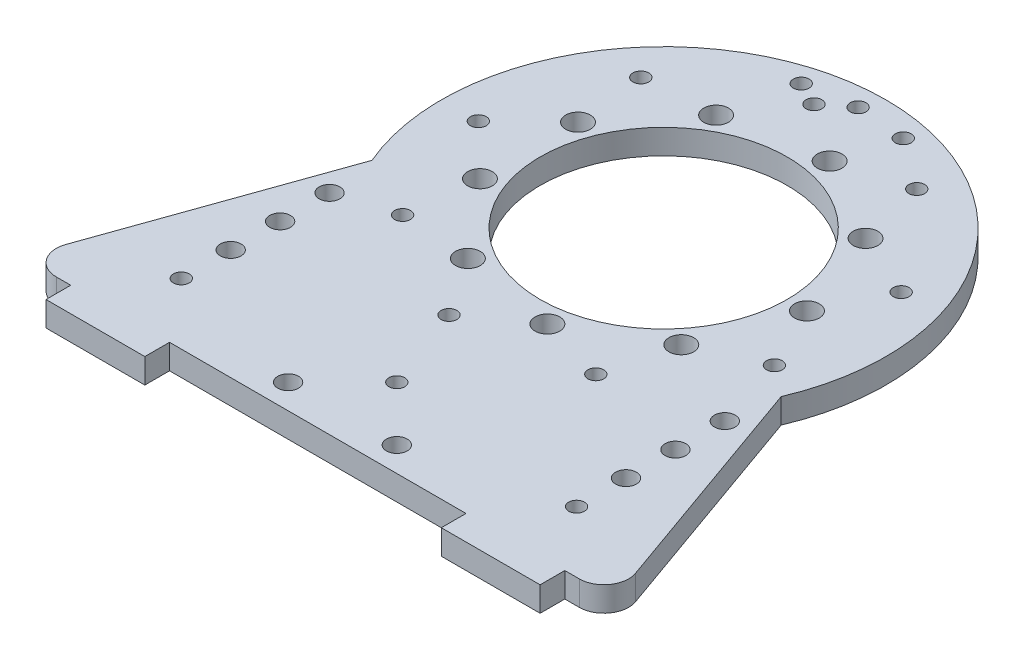
from build123d import *

# Parameters (mm, degrees)
SKETCH_1_R          = 25
SKETCH_1_R_2        = 1.6
SKETCH_1_R_3        = 2.1
EXTRUDE_1_DEPTH     = 2.5
SKETCH_3_R          = 2.5
CUT_EXTRUDE_1_DEPTH = 10
SKETCH_4_R          = 2.1
CUT_EXTRUDE_2_DEPTH = 10
SKETCH_5_W          = 20
SKETCH_5_H          = 5
EXTRUDE_2_DEPTH     = 5
CUT_EXTRUDE_3_DEPTH = 97.176920308
FILLET_1_R          = 5


with BuildPart() as part:
    # 草图1 → 凸台-拉伸1 (new, symmetric)
    with BuildSketch(Plane(origin=(0, 0, 0), x_dir=(1, 0, 0), z_dir=(0, 1, 0))):
        with BuildLine():
            Line((-60, 0), (-60, -70))
            Line((-60, -70), (60, -70))
            Line((60, -70), (60, 0))
            ThreePointArc((60, 0), (42.426406871, 42.426406871), (0, 60))
            ThreePointArc((0, 60), (-42.426406871, 42.426406871), (-60, 0))
        make_face()
        with Locations(Location((0, 0, 0), (0, 0, 270))):
            Circle(SKETCH_1_R, mode=Mode.SUBTRACT)
        with Locations(Location((-40, -57.62, 0), (0, 0, 270))):
            Circle(SKETCH_1_R_2, mode=Mode.SUBTRACT)
        with Locations(Location((40, -57.62, 0), (0, 0, 90))):
            Circle(SKETCH_1_R_2, mode=Mode.SUBTRACT)
        with Locations(Location((-37.5, 0, 0), (0, 0, 270))):
            Circle(SKETCH_1_R_2, mode=Mode.SUBTRACT)
        with Locations(Location((-28.726666617, 24.104535363, 0), (0, 0, 270))):
            Circle(SKETCH_1_R_2, mode=Mode.SUBTRACT)
        with Locations(Location((-6.511806663, 36.930290738, 0), (0, 0, 270))):
            Circle(SKETCH_1_R_2, mode=Mode.SUBTRACT)
        with Locations(Location((18.75, 32.475952642, 0), (0, 0, 270))):
            Circle(SKETCH_1_R_2, mode=Mode.SUBTRACT)
        with Locations(Location((35.238473279, 12.825755375, 0), (0, 0, 270))):
            Circle(SKETCH_1_R_2, mode=Mode.SUBTRACT)
        with Locations(Location((35.238473279, -12.825755375, 0), (0, 0, 270))):
            Circle(SKETCH_1_R_2, mode=Mode.SUBTRACT)
        with Locations(Location((18.75, -32.475952642, 0), (0, 0, 270))):
            Circle(SKETCH_1_R_2, mode=Mode.SUBTRACT)
        with Locations(Location((-6.511806663, -36.930290738, 0), (0, 0, 270))):
            Circle(SKETCH_1_R_2, mode=Mode.SUBTRACT)
        with Locations(Location((-28.726666617, -24.104535363, 0), (0, 0, 270))):
            Circle(SKETCH_1_R_2, mode=Mode.SUBTRACT)
        with Locations(Location((-11, -65, 0), (0, 0, 270))):
            Circle(SKETCH_1_R_3, mode=Mode.SUBTRACT)
        with Locations(Location((11, -65, 0), (0, 0, 90))):
            Circle(SKETCH_1_R_3, mode=Mode.SUBTRACT)
        with Locations(Location((0, -54, 0), (0, 0, 270))):
            Circle(SKETCH_1_R_2, mode=Mode.SUBTRACT)
        with Locations(Location((8.488193337, 40, 0), (0, 0, 270))):
            Circle(SKETCH_1_R_2, mode=Mode.SUBTRACT)
        with Locations(Location((-1.511806663, 40.862744239, 0), (0, 0, 270))):
            Circle(SKETCH_1_R_2, mode=Mode.SUBTRACT)
        with Locations(Location((-11.420717282, 39.263426275, 0), (0, 0, 270))):
            Circle(SKETCH_1_R_2, mode=Mode.SUBTRACT)
    extrude(amount=EXTRUDE_1_DEPTH, both=True)

    # 草图3 → 切除-拉伸1 (cut)
    with BuildSketch(Plane(origin=(0, 2.5, 0), x_dir=(1, 0, 0), z_dir=(0, 1, 0))):
        with Locations(Location((-27.251086003, -9.918584156, 0), (0, 0, 270))):
            Circle(SKETCH_3_R)
        with Locations(Location((-14.5, 25.11473671, 0), (0, 0, 270))):
            Circle(SKETCH_3_R)
        with Locations(Location((5.035797152, 28.559424837, 0), (0, 0, 270))):
            Circle(SKETCH_3_R)
        with Locations(Location((22.21528885, 18.640840681, 0), (0, 0, 270))):
            Circle(SKETCH_3_R)
        with Locations(Location((29, 0, 0), (0, 0, 270))):
            Circle(SKETCH_3_R)
        with Locations(Location((22.21528885, -18.640840681, 0), (0, 0, 270))):
            Circle(SKETCH_3_R)
        with Locations(Location((5.035797152, -28.559424837, 0), (0, 0, 270))):
            Circle(SKETCH_3_R)
        with Locations(Location((-14.5, -25.11473671, 0), (0, 0, 270))):
            Circle(SKETCH_3_R)
        with Locations(Location((-27.251086003, 9.918584156, 0), (0, 0, 270))):
            Circle(SKETCH_3_R)
    extrude(amount=-CUT_EXTRUDE_1_DEPTH, mode=Mode.SUBTRACT)

    # 草图4 → 切除-拉伸2 (cut)
    with BuildSketch(Plane(origin=(0, 2.5, 0), x_dir=(1, 0, 0), z_dir=(0, 1, 0))):
        with Locations(Location((-40, -47.62, 0), (0, 0, 270))):
            Circle(SKETCH_4_R)
        with Locations(Location((-40, -37.62, 0), (0, 0, 270))):
            Circle(SKETCH_4_R)
        with Locations(Location((-40, -27.62, 0), (0, 0, 270))):
            Circle(SKETCH_4_R)
        with Locations(Location((40, -47.62, 0), (0, 0, 270))):
            Circle(SKETCH_4_R)
        with Locations(Location((40, -37.62, 0), (0, 0, 270))):
            Circle(SKETCH_4_R)
        with Locations(Location((40, -27.62, 0), (0, 0, 270))):
            Circle(SKETCH_4_R)
    extrude(amount=-CUT_EXTRUDE_2_DEPTH, mode=Mode.SUBTRACT)

    # 草图5 → 凸台-拉伸2 (add)
    with BuildSketch(Plane.XY.offset(70)):
        with Locations((40, 0)):
            Rectangle(SKETCH_5_W, SKETCH_5_H)
        with Locations((-40, 0)):
            Rectangle(SKETCH_5_W, SKETCH_5_H)
    extrude(amount=EXTRUDE_2_DEPTH)

    # 草图7 → 切除-拉伸3 (cut, through all)
    with BuildSketch(Plane(origin=(0, 2.5, 0), x_dir=(1, 0, 0), z_dir=(0, 1, 0))):
        with BuildLine():
            Line((-41.406951107, -17.62), (-60, -70))
            Line((-60, -70), (-60, 0))
            ThreePointArc((-60, 0), (0, 60), (60, 0))
            Line((60, 0), (60, -70))
            Line((60, -70), (41.406951107, -17.62))
            ThreePointArc((41.406951107, -17.62), (0, 45), (-41.406951107, -17.62))
        make_face()
    extrude(amount=-CUT_EXTRUDE_3_DEPTH, mode=Mode.SUBTRACT)

    # 圆角1
    fillet_1_edges = [part.edges().sort_by_distance(p)[0] for p in [
        (60, 0, 70),
        (-60, 0, 70),
    ]]
    fillet(fillet_1_edges, radius=FILLET_1_R)


solid = part.part
